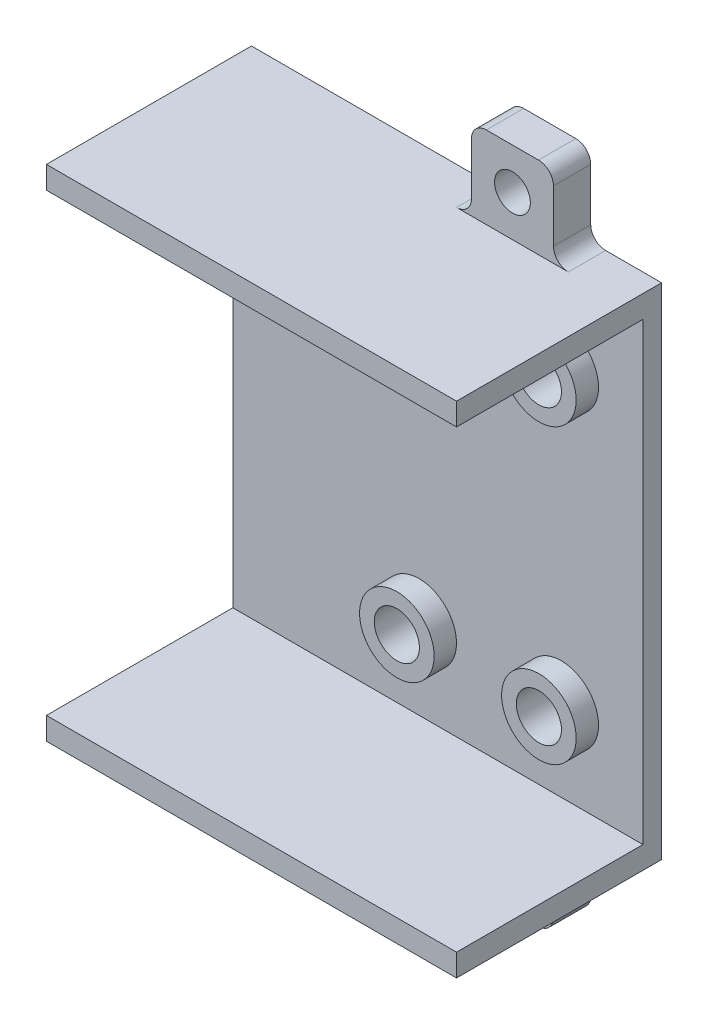
from build123d import *

# Parameters (mm, degrees)
SKETCH1_W            = 55
SKETCH1_H            = 67
BOSS_EXTRUDE1_DEPTH  = 2.5
SKETCH2_W            = 55
SKETCH2_H            = 3
BOSS_EXTRUDE2_DEPTH  = 25
SKETCH3_R            = 5
SKETCH3_R_2          = 3.025
BOSS_EXTRUDE3_DEPTH  = 3
CUT_EXTRUDE1_START   = -2
SKETCH4_R            = 3.025
CUT_EXTRUDE1_DEPTH   = 2
SKETCH5_W            = 5.5
SKETCH5_H            = 11
BOSS_EXTRUDE4_DEPTH  = 5
M4_CLEARANCE_HOLE1_D = 4.8
FILLET3_R            = 2


with BuildPart() as part:
    # Sketch1 → Boss-Extrude1 (new body)
    with BuildSketch(Plane.XY):
        Rectangle(SKETCH1_W, SKETCH1_H)
    extrude(amount=BOSS_EXTRUDE1_DEPTH)

    # Sketch2 → Boss-Extrude2 (add)
    with BuildSketch(Plane.XY.offset(2.5)):
        with Locations((0, 32)):
            Rectangle(SKETCH2_W, SKETCH2_H)
        with Locations((0, -32)):
            Rectangle(SKETCH2_W, SKETCH2_H)
    extrude(amount=BOSS_EXTRUDE2_DEPTH)

    # Sketch3 → Boss-Extrude3 (add)
    # profile 1 of 4: a face of its own
    with BuildSketch(Plane.XY.offset(2.5)):
        with Locations((-2.504, 19.6215)):
            Circle(SKETCH3_R)
        with Locations((-2.504, 19.6215)):
            Circle(SKETCH3_R_2, mode=Mode.SUBTRACT)
    # profile 2 of 4: a face of its own
    with BuildSketch(Plane.XY.offset(2.5)):
        with Locations((16.546, 19.6215)):
            Circle(SKETCH3_R)
        with Locations((16.546, 19.6215)):
            Circle(SKETCH3_R_2, mode=Mode.SUBTRACT)
    # profile 3 of 4: a face of its own
    with BuildSketch(Plane.XY.offset(2.5)):
        with Locations((16.546, -19.6215)):
            Circle(SKETCH3_R)
        with Locations((16.546, -19.6215)):
            Circle(SKETCH3_R_2, mode=Mode.SUBTRACT)
    # profile 4 of 4: a face of its own
    with BuildSketch(Plane.XY.offset(2.5)):
        with Locations((-2.504, -19.6215)):
            Circle(SKETCH3_R)
        with Locations((-2.504, -19.6215)):
            Circle(SKETCH3_R_2, mode=Mode.SUBTRACT)
    extrude(amount=BOSS_EXTRUDE3_DEPTH)

    # Sketch4 → Cut-Extrude1 (cut)
    with BuildSketch(Plane.XY.offset(2.5).offset(CUT_EXTRUDE1_START)):
        with Locations((16.546, -19.6215)):
            Circle(SKETCH4_R)
        with Locations((-2.504, -19.6215)):
            Circle(SKETCH4_R)
        with Locations((16.546, 19.6215)):
            Circle(SKETCH4_R)
        with Locations((-2.504, 19.6215)):
            Circle(SKETCH4_R)
    extrude(amount=CUT_EXTRUDE1_DEPTH, mode=Mode.SUBTRACT)

    # Sketch5 → Boss-Extrude4 (add)
    with BuildSketch(Plane(origin=(0, 0, 0), x_dir=(-1, 0, 0), z_dir=(0, 0, -1))):
        with Locations((-9.75, 39)):
            Rectangle(SKETCH5_W, SKETCH5_H)
        with Locations((-15.25, 39)):
            Rectangle(SKETCH5_W, SKETCH5_H)
    boss_extrude4 = extrude(amount=-BOSS_EXTRUDE4_DEPTH)

    # M4 Clearance Hole1 (through all)
    with Locations(Plane.XY.offset(5)):
        with Locations((12.5, 39)):
            m4_clearance_hole1 = Hole(M4_CLEARANCE_HOLE1_D / 2)

    # Mirror2: Boss-Extrude4, M4 Clearance Hole1 across plane
    add(boss_extrude4.mirror(Plane.ZX))
    add(m4_clearance_hole1.mirror(Plane.ZX), mode=Mode.SUBTRACT)

    # Fillet3
    fillet3_edges = [part.edges().sort_by_distance(p)[0] for p in [
        (7, -44.5, 2.5),
        (18, -44.5, 2.5),
        (18, -33.5, 2.5),
        (7, -33.5, 2.5),
        (18, 44.5, 2.5),
        (7, 44.5, 2.5),
        (7, 33.5, 2.5),
        (18, 33.5, 2.5),
    ]]
    fillet(fillet3_edges, radius=FILLET3_R)


solid = part.part
